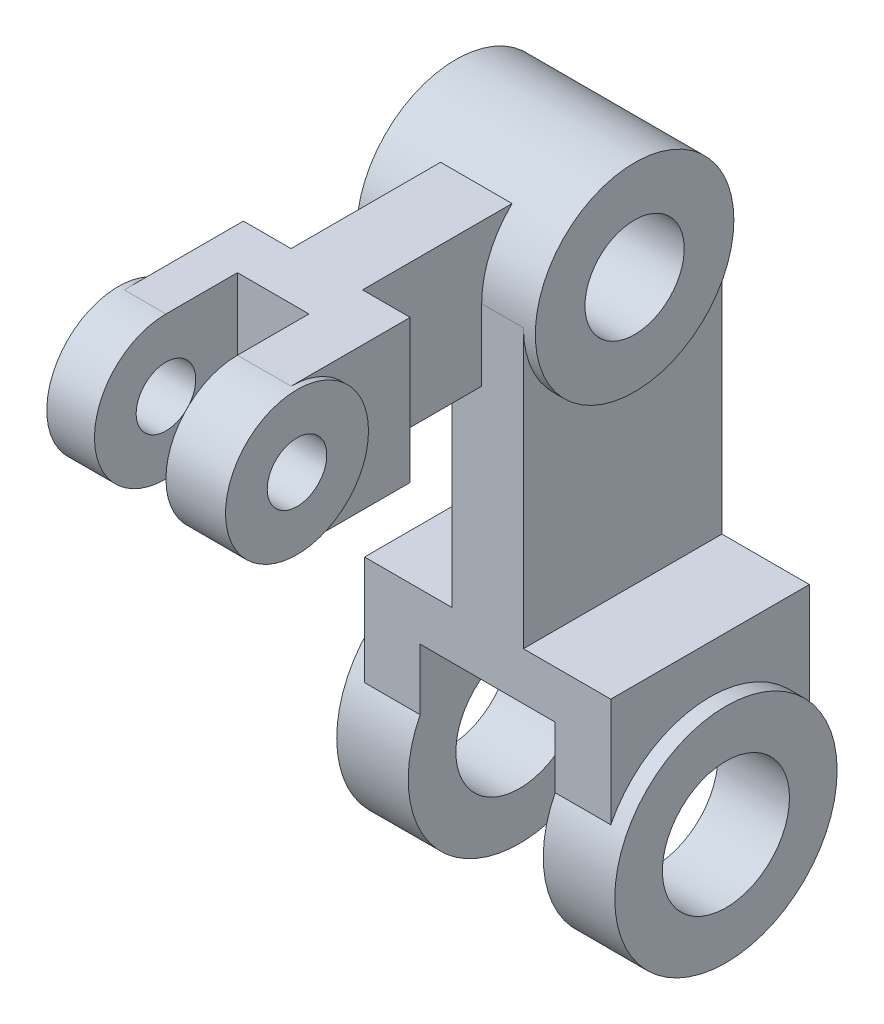
from build123d import *

# Parameters (mm, degrees)
ESQUISSE1_R                  = 18
ESQUISSE1_R_2                = 7.5
BOSS_EXTRU_1_DEPTH           = 45
ESQUISSE1_R_3                = 25
ESQUISSE1_R_4                = 12.5
BOSS_EXTRU_1_2_DEPTH         = 45
BOSS_EXTRU_2_START           = -3
BOSS_EXTRU_2_DEPTH           = 18
ESQUISSE4_R                  = 28
ESQUISSE4_R_2                = 16
BOSS_EXTRU_3_DEPTH           = 35
BOSS_EXTRU_4_DEPTH           = 31
ENL_V_MAT_EXTRU_1_DEPTH      = 201.129957777
ENL_V_MAT_EXTRU_1_DEPTH_BACK = 201.129957777
ESQUISSE6_W                  = 34
ESQUISSE6_H                  = 56
BOSS_EXTRU_5_DEPTH           = 21
BOSS_EXTRU_6_DEPTH           = 9
ESQUISSE10_W                 = 18
ESQUISSE10_H                 = 36
ENL_V_MAT_EXTRU_2_DEPTH      = 205.276773031


with BuildPart() as part:
    # Esquisse1 → Boss.-Extru.1 (new body)
    with BuildSketch(Plane(origin=(0, 0, 0), x_dir=(0, 0, -1), z_dir=(1, 0, 0))):
        Circle(ESQUISSE1_R)
        Circle(ESQUISSE1_R_2, mode=Mode.SUBTRACT)
    extrude(amount=BOSS_EXTRU_1_DEPTH)

    # Esquisse7 → Boss.-Extru.5 (add, symmetric)
    with BuildSketch(Plane.ZY.offset(-22.5)):
        with BuildLine():
            ThreePointArc((0, -18), (-18, 0), (0, 18))
            Line((0, 18), (-30, 18))
            Line((-30, 18), (-30, -18))
            Line((-30, -18), (0, -18))
        make_face()
    extrude(amount=BOSS_EXTRU_5_DEPTH, both=True)



with BuildPart() as body_2:
    # Esquisse1 → Boss.-Extru.1 2 (new body)
    with BuildSketch(Plane(origin=(0, 0, 0), x_dir=(0, 0, -1), z_dir=(1, 0, 0))):
        with Locations((85, 0)):
            Circle(ESQUISSE1_R_3)
        with Locations((85, 0)):
            Circle(ESQUISSE1_R_4, mode=Mode.SUBTRACT)
    extrude(amount=BOSS_EXTRU_1_2_DEPTH)

    # Esquisse3 → Boss.-Extru.2 (add)
    with BuildSketch(Plane(origin=(45, 0, 0), x_dir=(0, 0, -1), z_dir=(1, 0, 0)).offset(BOSS_EXTRU_2_START)):
        with BuildLine():
            Line((60, 0), (60, -70))
            Line((60, -70), (110, -70))
            Line((110, -70), (110, 0))
            ThreePointArc((110, 0), (85, -25), (60, 0))
        make_face()
    extrude(amount=-BOSS_EXTRU_2_DEPTH)



with BuildPart() as body_3:
    # Esquisse4 → Boss.-Extru.3 (new, symmetric)
    with BuildSketch(Plane(origin=(33, 0, 0), x_dir=(0, 0, -1), z_dir=(1, 0, 0))):
        with Locations((85, -110)):
            Circle(ESQUISSE4_R)
        with Locations((85, -110)):
            Circle(ESQUISSE4_R_2, mode=Mode.SUBTRACT)
    extrude(amount=BOSS_EXTRU_3_DEPTH, both=True)


with BuildPart() as body_2_1:
    add(body_2.part)

    add(body_3.part)  # Boss.-Extru.4 merges body 3
    # Esquisse5 → Boss.-Extru.4 (add, symmetric)
    with BuildSketch(Plane(origin=(33, 0, 0), x_dir=(0, 0, -1), z_dir=(1, 0, 0))):
        with BuildLine():
            Line((60, -70), (60, -97.390479787))
            ThreePointArc((60, -97.390479787), (85, -82), (110, -97.390479787))
            Line((110, -97.390479787), (110, -70))
            Line((110, -70), (60, -70))
        make_face()
    extrude(amount=BOSS_EXTRU_4_DEPTH, both=True)

    # Esquisse6 → Enlèv. mat.-Extru.1 (cut, two sides: drawn at the far end of the back side and taken through both)
    with BuildSketch(Plane(origin=(0, 0, -110), x_dir=(-1, 0, 0), z_dir=(0, 0, -1)).offset(-ENL_V_MAT_EXTRU_1_DEPTH_BACK)):
        with Locations((-33, -110)):
            Rectangle(ESQUISSE6_W, ESQUISSE6_H)
    extrude(amount=ENL_V_MAT_EXTRU_1_DEPTH + ENL_V_MAT_EXTRU_1_DEPTH_BACK, mode=Mode.SUBTRACT)


with BuildPart() as part_1:
    add(part.part)

    add(body_2_1.part)  # Boss.-Extru.6 merges body 2
    # Esquisse7<4> → Boss.-Extru.6 (add, symmetric)
    with BuildSketch(Plane.ZY.offset(-22.5)):
        with BuildLine():
            Line((-30, -18), (-30, 18))
            Line((-30, 18), (-67.650648427, 18))
            ThreePointArc((-67.650648427, 18), (-60, 0), (-67.650648427, -18))
            Line((-67.650648427, -18), (-30, -18))
        make_face()
    extrude(amount=BOSS_EXTRU_6_DEPTH, both=True)

    # Esquisse10 → Enlèv. mat.-Extru.2 (cut, through all)
    with BuildSketch(Plane(origin=(0, 18, 0), x_dir=(1, 0, 0), z_dir=(0, 1, 0))):
        with Locations((21, 0)):
            Rectangle(ESQUISSE10_W, ESQUISSE10_H)
    extrude(amount=-ENL_V_MAT_EXTRU_2_DEPTH, mode=Mode.SUBTRACT)


solid = part_1.part
